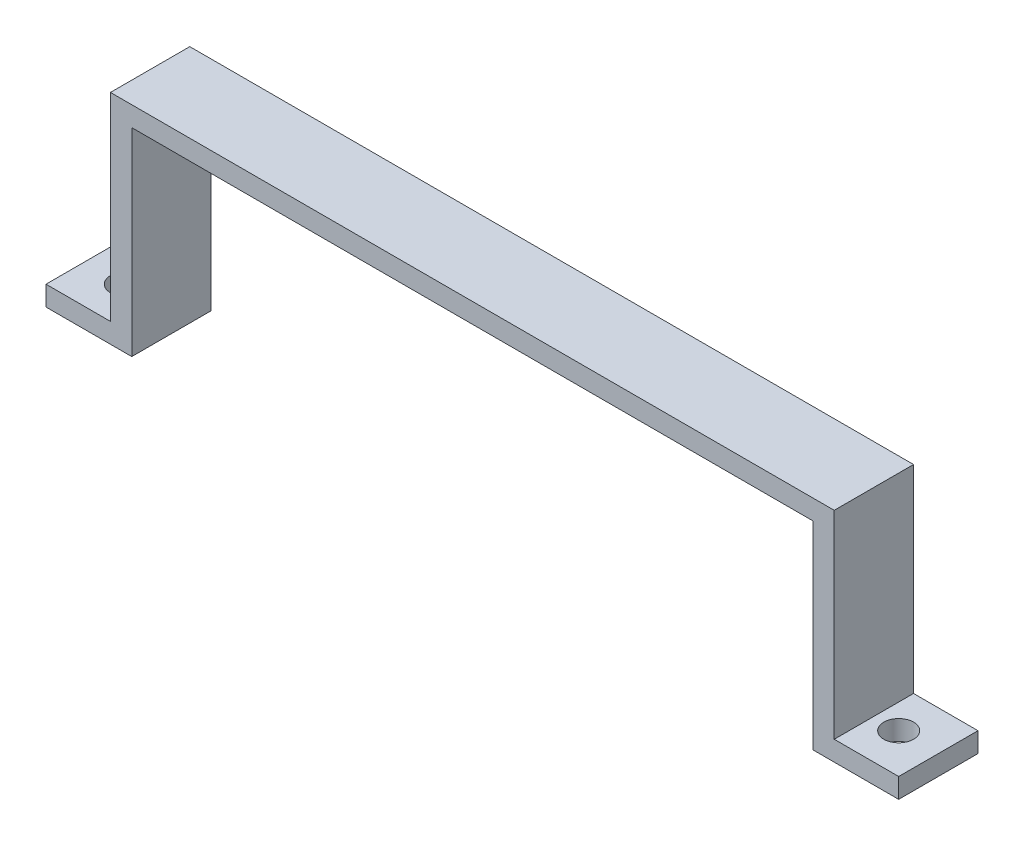
from build123d import *

# Parameters (mm, degrees)
SKETCH_1_W      = 73
SKETCH_1_H      = 8
EXTRUDE_1_DEPTH = 2
SKETCH_1_15_W   = 2.15
SKETCH_1_15_H   = 8
EXTRUDE_2_DEPTH = 20
EXTRUDE_START   = -20
SKETCH_1_16_W   = 6.5
SKETCH_1_16_H   = 8
SKETCH_1_16_R   = 1.5
EXTRUDE_3_DEPTH = 2


with BuildPart() as part:
    # 草图1 → 凸台-拉伸1 (new body)
    with BuildSketch(Plane(origin=(0, 0, 0), x_dir=(1, 0, 0), z_dir=(0, 1, 0))):
        Rectangle(SKETCH_1_W, SKETCH_1_H)
    extrude(amount=EXTRUDE_1_DEPTH)

    # 草图1<15> → 凸台-拉伸2 (add)
    with BuildSketch(Plane(origin=(0, 0, 0), x_dir=(1, 0, 0), z_dir=(0, 1, 0))):
        with Locations((-35.425, 0)):
            Rectangle(SKETCH_1_15_W, SKETCH_1_15_H)
        with Locations((35.425, 0)):
            Rectangle(SKETCH_1_15_W, SKETCH_1_15_H)
    extrude(amount=-EXTRUDE_2_DEPTH)

    # 草图1<16> → 凸台-拉伸3 (add)
    # profile 1 of 2: a face of its own
    with BuildSketch(Plane(origin=(0, 0, 0), x_dir=(1, 0, 0), z_dir=(0, 1, 0)).offset(EXTRUDE_START)):
        with Locations((-39.75, 0)):
            Rectangle(SKETCH_1_16_W, SKETCH_1_16_H)
        with Locations(Location((-39, 0, 0), (0, 0, 270))):
            Circle(SKETCH_1_16_R, mode=Mode.SUBTRACT)
    # profile 2 of 2: a face of its own
    with BuildSketch(Plane(origin=(0, 0, 0), x_dir=(1, 0, 0), z_dir=(0, 1, 0)).offset(EXTRUDE_START)):
        with Locations((39.75, 0)):
            Rectangle(SKETCH_1_16_W, SKETCH_1_16_H)
        with Locations(Location((39, 0, 0), (0, 0, 270))):
            Circle(SKETCH_1_16_R, mode=Mode.SUBTRACT)
    extrude(amount=EXTRUDE_3_DEPTH)


solid = part.part
